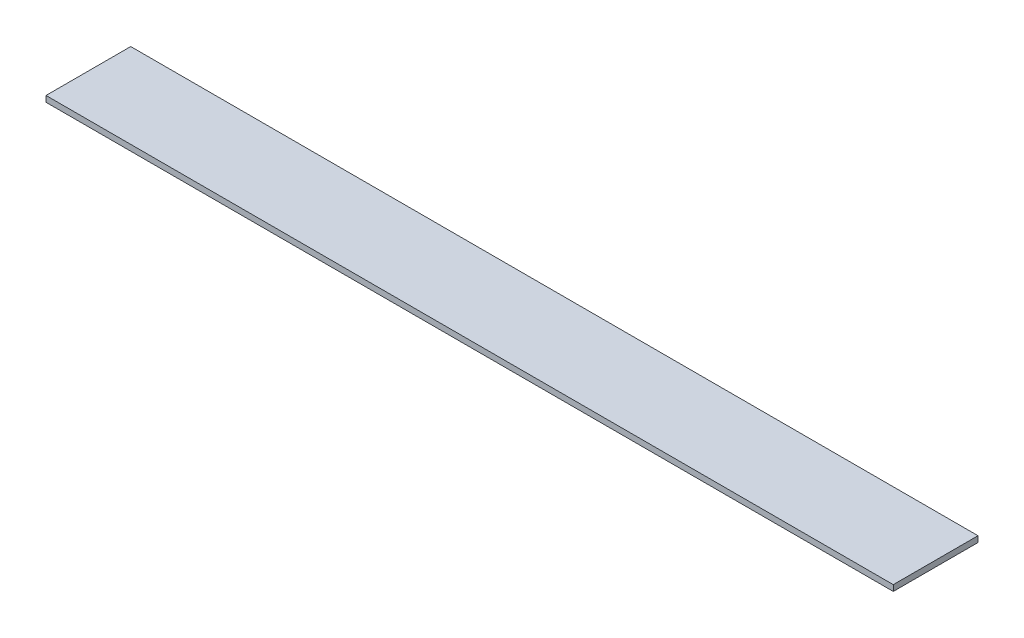
from build123d import *

# Parameters (mm, degrees)
SKETCH1_W           = 100
SKETCH1_H           = 10
BOSS_EXTRUDE1_DEPTH = 0.7


with BuildPart() as part:
    # Sketch1 → Boss-Extrude1 (new body)
    with BuildSketch(Plane(origin=(0, 0, 0), x_dir=(1, 0, 0), z_dir=(0, 1, 0))):
        Rectangle(SKETCH1_W, SKETCH1_H)
    extrude(amount=BOSS_EXTRUDE1_DEPTH)


solid = part.part
